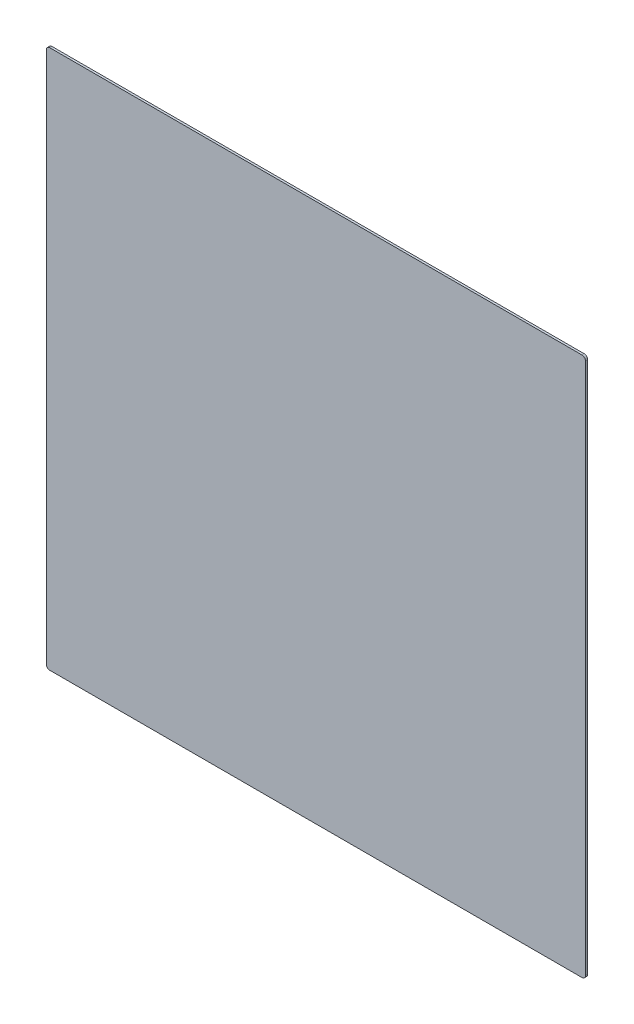
from build123d import *

# Parameters (mm, degrees)
SKETCH1_W           = 305
SKETCH1_H           = 305
BOSS_EXTRUDE1_DEPTH = 1.25
FILLET1_R           = 2


with BuildPart() as part:
    # Sketch1 → Boss-Extrude1 (new body)
    with BuildSketch(Plane.XY):
        Rectangle(SKETCH1_W, SKETCH1_H)
    extrude(amount=BOSS_EXTRUDE1_DEPTH)

    # Fillet1
    fillet1_edges = [part.edges().sort_by_distance(p)[0] for p in [
        (152.5, -152.5, 0.625),
        (-152.5, -152.5, 0.625),
        (-152.5, 152.5, 0.625),
        (152.5, 152.5, 0.625),
    ]]
    fillet(fillet1_edges, radius=FILLET1_R)


solid = part.part
